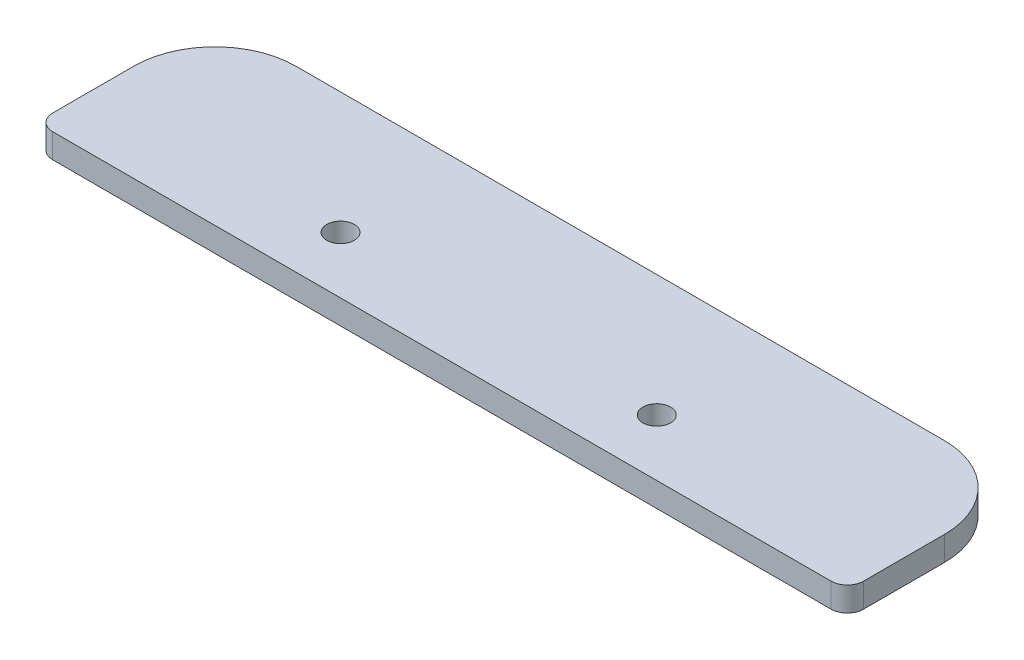
from build123d import *

# Parameters (mm, degrees)
SKETCH1_W           = 100
SKETCH1_H           = 22
BOSS_EXTRUDE1_DEPTH = 3
SKETCH2_R           = 1.7
CUT_EXTRUDE1_DEPTH  = 3
FILLET1_R           = 10
FILLET2_R           = 2


with BuildPart() as part:
    # Sketch1 → Boss-Extrude1 (new body)
    with BuildSketch(Plane(origin=(0, 12, 0), x_dir=(1, 0, 0), z_dir=(0, 1, 0))):
        with Locations((0, 39)):
            Rectangle(SKETCH1_W, SKETCH1_H)
    extrude(amount=BOSS_EXTRUDE1_DEPTH)

    # Sketch2 → Cut-Extrude1 (cut)
    with BuildSketch(Plane(origin=(0, 15, 0), x_dir=(1, 0, 0), z_dir=(0, 1, 0))):
        with Locations(Location((-19.5, 35, 0), (0, 0, 270))):
            Circle(SKETCH2_R)
        with Locations(Location((19.5, 35, 0), (0, 0, 270))):
            Circle(SKETCH2_R)
    extrude(amount=-CUT_EXTRUDE1_DEPTH, mode=Mode.SUBTRACT)

    # Fillet1
    fillet1_edges = [part.edges().sort_by_distance(p)[0] for p in [
        (-50, 13.5, -50),
        (50, 13.5, -50),
    ]]
    fillet(fillet1_edges, radius=FILLET1_R)

    # Fillet2
    fillet2_edges = [part.edges().sort_by_distance(p)[0] for p in [
        (50, 13.5, -28),
        (-50, 13.5, -28),
    ]]
    fillet(fillet2_edges, radius=FILLET2_R)


solid = part.part
